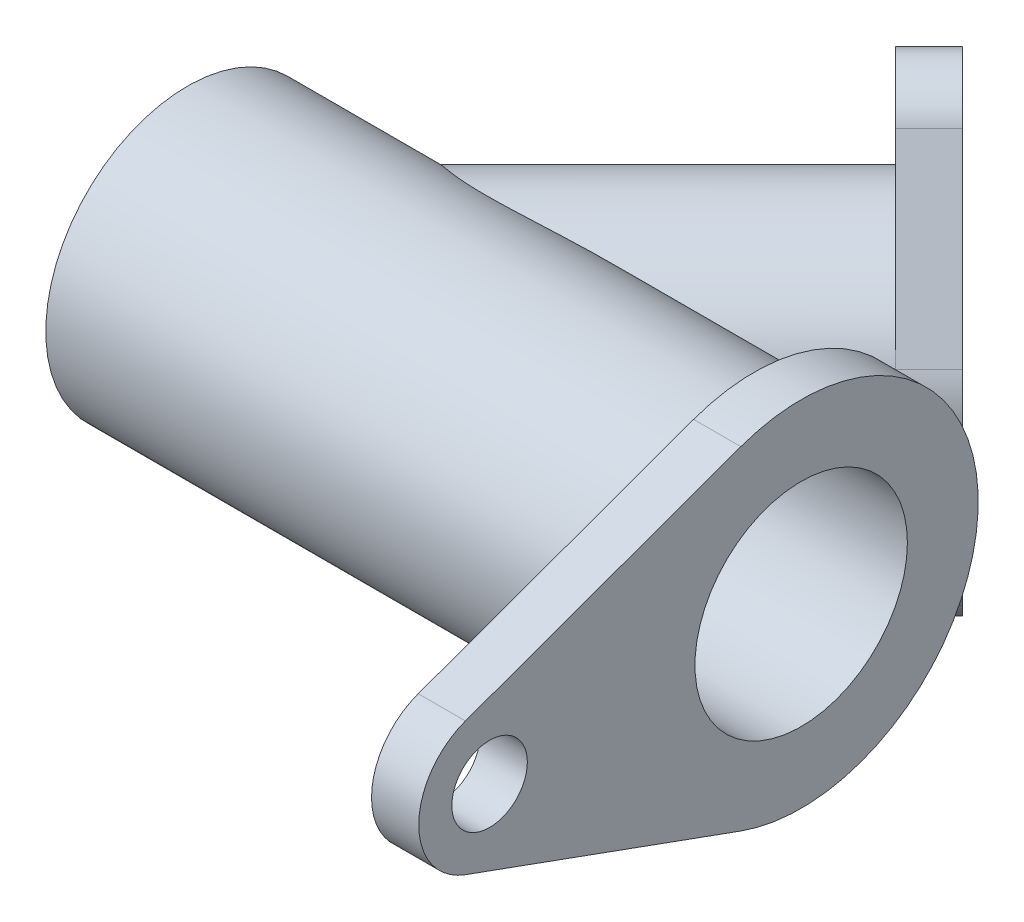
from build123d import *

# Parameters (mm, degrees)
SKETCH_1_R           = 60
SKETCH_1_R_2         = 45
EXTRUDE_1_DEPTH      = 240
SKETCH_2_R           = 45
SKETCH_2_R_2         = 16
EXTRUDE_2_DEPTH      = 20
EXTRUDE_4_REACH      = 356.216
EXTRUDE_4_END_RADIUS = 60
SKETCH_15_R          = 50
SKETCH_15_R_2        = 30
CUT_EXTRUDE_1_REACH  = 356.216
SKETCH_18_R          = 30
EXTRUDE_START        = 20
SKETCH_19_R          = 30
SKETCH_19_R_2        = 10
EXTRUDE_6_DEPTH      = 20


with BuildPart() as part:
    # 草图1 → 凸台-拉伸1 (new body)
    with BuildSketch(Plane(origin=(0, 0, 0), x_dir=(0, 0, -1), z_dir=(1, 0, 0))):
        Circle(SKETCH_1_R)
        Circle(SKETCH_1_R_2, mode=Mode.SUBTRACT)
    extrude(amount=EXTRUDE_1_DEPTH)

    # 草图2 → 凸台-拉伸2 (add)
    with BuildSketch(Plane(origin=(240, 0, 0), x_dir=(0, 0, -1), z_dir=(1, 0, 0))):
        with BuildLine():
            Line((-142.227272727, 28.202888018), (-25.568181818, 70.507220045))
            ThreePointArc((-25.568181818, 70.507220045), (75, 0), (-25.568181818, -70.507220045))
            Line((-25.568181818, -70.507220045), (-142.227272727, -28.202888018))
            ThreePointArc((-142.227272727, -28.202888018), (-162, 0), (-142.227272727, 28.202888018))
        make_face()
        Circle(SKETCH_2_R, mode=Mode.SUBTRACT)
        with Locations((-132, 0)):
            Circle(SKETCH_2_R_2, mode=Mode.SUBTRACT)
    extrude(amount=EXTRUDE_2_DEPTH)

    # 凸台-拉伸4: up to this cylinder (the profile starts outside it)
    extrude_4_end = Plane(origin=(214.355339, 0, 0), z_dir=(-1, 0, 0)) * Cylinder(EXTRUDE_4_END_RADIUS, 833.432, mode=Mode.PRIVATE)
    # 草图15 → 凸台-拉伸4 (add, up to the surface)
    with BuildSketch(Plane(origin=(150, 0, -150), x_dir=(-0.7071067811865465, 2.3800392787790966e-15, -0.7071067811865487), z_dir=(0.7071067811865487, -2.3800392787791053e-15, -0.7071067811865465)), mode=Mode.PRIVATE) as extrude_4_sk1:
        with Locations((-42.426406871, 0)):
            Circle(SKETCH_15_R)
        with Locations((-42.426406871, 0)):
            Circle(SKETCH_15_R_2, mode=Mode.SUBTRACT)
    extrude_4_tool1 = extrude(extrude_4_sk1.sketch, amount=-EXTRUDE_4_REACH, mode=Mode.PRIVATE) - extrude_4_end
    add(extrude_4_tool1.solids().sort_by_distance((214.355339, 0, -85.644661))[0])

    # 草图18 → 切除-拉伸1 (cut, up to next)
    with BuildSketch(Plane(origin=(150, 0, -150), x_dir=(-0.7071067811865465, 2.3800392787790978e-15, -0.7071067811865486), z_dir=(0.7071067811865486, -2.380039278779105e-15, -0.7071067811865465)), mode=Mode.PRIVATE) as cut_extrude_1_sk1:
        with Locations((-42.426406871, 0)):
            Circle(SKETCH_18_R)
    cut_extrude_1_tool1 = extrude(cut_extrude_1_sk1.sketch, amount=-CUT_EXTRUDE_1_REACH, mode=Mode.PRIVATE) & part.part
    add(cut_extrude_1_tool1.solids().sort_by_distance((180, 0, -120))[0], mode=Mode.SUBTRACT)

    # 草图19 → 凸台-拉伸6 (add)
    with BuildSketch(Plane(origin=(150, 0, -150), x_dir=(-0.7071067811865465, 2.3800392787790978e-15, -0.7071067811865486), z_dir=(0.7071067811865486, -2.380039278779105e-15, -0.7071067811865465)).offset(EXTRUDE_START)):
        with BuildLine():
            Line((-60.966903089, 87.5), (-88.777647416, 18.75))
            ThreePointArc((-88.777647416, 18.75), (-92.426406871, 0), (-88.777647416, -18.75))
            Line((-88.777647416, -18.75), (-60.966903089, -87.5))
            ThreePointArc((-60.966903089, -87.5), (-42.426406871, -100), (-23.885910653, -87.5))
            Line((-23.885910653, -87.5), (3.924833673, -18.75))
            ThreePointArc((3.924833673, -18.75), (7.573593129, 0), (3.924833673, 18.75))
            Line((3.924833673, 18.75), (-23.885910653, 87.5))
            ThreePointArc((-23.885910653, 87.5), (-42.426406871, 100), (-60.966903089, 87.5))
        make_face()
        with Locations((-42.426406871, 0)):
            Circle(SKETCH_19_R, mode=Mode.SUBTRACT)
        with Locations((-42.426406871, 80)):
            Circle(SKETCH_19_R_2, mode=Mode.SUBTRACT)
        with Locations((-42.426406871, -80)):
            Circle(SKETCH_19_R_2, mode=Mode.SUBTRACT)
    extrude(amount=-EXTRUDE_6_DEPTH)


solid = part.part
